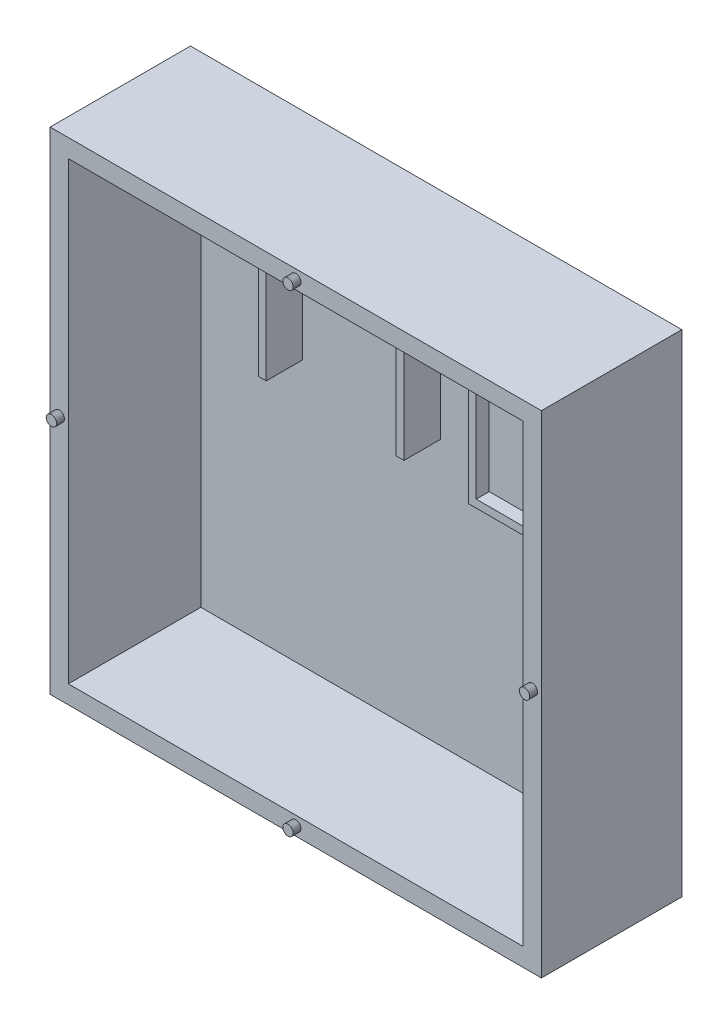
from build123d import *

# Parameters (mm, degrees)
SKETCH1_W           = 188.999995589
SKETCH1_H           = 188.999995589
BOSS_EXTRUDE1_DEPTH = 54.000001401
BOSS_EXTRUDE2_DEPTH = 2.999998629
BOSS_EXTRUDE3_DEPTH = 2.999998629
BOSS_EXTRUDE4_DEPTH = 2.999998629
BOSS_EXTRUDE5_DEPTH = 2.999998629
SKETCH6_W           = 174.999997486
SKETCH6_H           = 174.999997486
CUT_EXTRUDE1_DEPTH  = 51.000001375
BOSS_EXTRUDE6_DEPTH = 14.000000898
SKETCH8_W           = 40.000014007
SKETCH8_H           = 68.999998271
BOSS_EXTRUDE7_DEPTH = 5.000000354
SKETCH9_W           = 34.000001848
SKETCH9_H           = 63.000008464
CUT_EXTRUDE2_DEPTH  = 5.000000354


with BuildPart() as part:
    # Sketch1 → Boss-Extrude1 (new body)
    with BuildSketch(Plane(origin=(0, 0, 0), x_dir=(-1, 0, 0), z_dir=(0, 0, -1))):
        with Locations((-94.499997795, 94.499997795)):
            Rectangle(SKETCH1_W, SKETCH1_H)
    extrude(amount=-BOSS_EXTRUDE1_DEPTH)

    # Sketch2 → Boss-Extrude2 (add)
    with BuildSketch(Plane.XY.offset(54.000001401)):
        Polygon((3.152705729, 96.469610929), (3.49999941, 96.500001848), (3.847301006, 96.469610929), (4.184044898, 96.379376948), (4.500002135, 96.232049167), (4.785574973, 96.032083035), (5.032091867, 95.785565674), (5.232051015, 95.499992371), (5.379386246, 95.184035599), (5.469620228, 94.847291708), (5.500003695, 94.499990344), (5.469620228, 94.152703881), (5.379386246, 93.815952539), (5.232051015, 93.499995768), (5.032091867, 93.214422464), (4.785574973, 92.967912555), (4.500002135, 92.767946422), (4.184044898, 92.620611191), (3.847301006, 92.530377209), (3.49999941, 92.500001192), (3.152705729, 92.530377209), (2.815961838, 92.620611191), (2.500005066, 92.767946422), (2.214424312, 92.967912555), (1.967914402, 93.214422464), (1.76794827, 93.499995768), (1.620620489, 93.815952539), (1.530386391, 94.152703881), (1.500003156, 94.499990344), (1.530386391, 94.847291708), (1.620620489, 95.184035599), (1.76794827, 95.499992371), (1.967914402, 95.785565674), (2.214424312, 96.032083035), (2.500005066, 96.232049167), (2.815961838, 96.379376948), align=None)
    extrude(amount=BOSS_EXTRUDE2_DEPTH)

    # Sketch3 → Boss-Extrude3 (add)
    with BuildSketch(Plane.XY.offset(54.000001401)):
        Polygon((96.032090485, 184.214413166), (95.785573125, 183.967918158), (95.499999821, 183.767944574), (95.18404305, 183.620601892), (94.847299159, 183.530375361), (94.499997795, 183.500006795), (94.152703881, 183.530375361), (93.815967441, 183.620601892), (93.500003219, 183.767944574), (93.214422464, 183.967918158), (92.967912555, 184.214413166), (92.767953873, 184.49999392), (92.620611191, 184.815958142), (92.53038466, 185.152694583), (92.500001192, 185.499995947), (92.53038466, 185.847297311), (92.620611191, 186.184033751), (92.767953873, 186.499997973), (92.967912555, 186.785563827), (93.214422464, 187.032088637), (93.500003219, 187.232047319), (93.815967441, 187.3793751), (94.152703881, 187.469601631), (94.499997795, 187.5), (94.847299159, 187.469601631), (95.18404305, 187.3793751), (95.499999821, 187.232047319), (95.785573125, 187.032088637), (96.032090485, 186.785563827), (96.232056618, 186.499997973), (96.379384398, 186.184033751), (96.46961838, 185.847297311), (96.500001848, 185.499995947), (96.46961838, 185.152694583), (96.379384398, 184.815958142), (96.232056618, 184.49999392), align=None)
    extrude(amount=BOSS_EXTRUDE3_DEPTH)

    # Sketch4 → Boss-Extrude4 (add)
    with BuildSketch(Plane.XY.offset(54.000001401)):
        Polygon((185.847297311, 92.530377209), (185.499995947, 92.500001192), (185.152694583, 92.530377209), (184.815958142, 92.620611191), (184.49999392, 92.767946422), (184.214428067, 92.967912555), (183.967918158, 93.214422464), (183.767959476, 93.499995768), (183.620616794, 93.815952539), (183.530375361, 94.152703881), (183.500006795, 94.499990344), (183.530375361, 94.847291708), (183.620616794, 95.184035599), (183.767959476, 95.499992371), (183.967918158, 95.785565674), (184.214428067, 96.032083035), (184.49999392, 96.232049167), (184.815958142, 96.379376948), (185.152694583, 96.469610929), (185.499995947, 96.500001848), (185.847297311, 96.469610929), (186.184033751, 96.379376948), (186.499997973, 96.232049167), (186.785578728, 96.032083035), (187.032088637, 95.785565674), (187.232062221, 95.499992371), (187.379390001, 95.184035599), (187.469616532, 94.847291708), (187.5, 94.499990344), (187.469616532, 94.152703881), (187.379390001, 93.815952539), (187.232062221, 93.499995768), (187.032088637, 93.214422464), (186.785578728, 92.967912555), (186.499997973, 92.767946422), (186.184033751, 92.620611191), align=None)
    extrude(amount=BOSS_EXTRUDE4_DEPTH)

    # Sketch5 → Boss-Extrude5 (add)
    with BuildSketch(Plane.XY.offset(54.000001401)):
        Polygon((92.967912555, 2.214424312), (92.767953873, 2.499997616), (92.620611191, 2.815954387), (92.53038466, 3.152698278), (92.500001192, 3.49999941), (92.53038466, 3.847293556), (92.620611191, 4.184036981), (92.767953873, 4.499994218), (92.967912555, 4.785574973), (93.214422464, 5.032084882), (93.500003219, 5.232051015), (93.815967441, 5.379378796), (94.152703881, 5.469612777), (94.499997795, 5.499996245), (94.847299159, 5.469612777), (95.18404305, 5.379378796), (95.499999821, 5.232051015), (95.785573125, 5.032084882), (96.032090485, 4.785574973), (96.232056618, 4.499994218), (96.379384398, 4.184036981), (96.46961838, 3.847293556), (96.500001848, 3.49999941), (96.46961838, 3.152698278), (96.379384398, 2.815954387), (96.232056618, 2.499997616), (96.032090485, 2.214424312), (95.785573125, 1.967906952), (95.499999821, 1.76794827), (95.18404305, 1.620613155), (94.847299159, 1.530379057), (94.499997795, 1.499995589), (94.152703881, 1.530379057), (93.815967441, 1.620613155), (93.500003219, 1.76794827), (93.214422464, 1.967906952), align=None)
    extrude(amount=BOSS_EXTRUDE5_DEPTH)

    # Sketch6 → Cut-Extrude1 (cut)
    with BuildSketch(Plane.XY.offset(54.000001401)):
        with Locations((94.499997562, 94.499997562)):
            Rectangle(SKETCH6_W, SKETCH6_H)
    extrude(amount=-CUT_EXTRUDE1_DEPTH, mode=Mode.SUBTRACT)

    # Sketch7 → Boss-Extrude6 (add)
    with BuildSketch(Plane.XY.offset(3.000000026)):
        Polygon((96.136428416, 160.99999845), (46.136427671, 160.99999845), (46.136427671, 108.999997377), (43.136429042, 108.999997377), (43.136429042, 164.00000453), (99.136427045, 164.00000453), (99.136427045, 108.999997377), (96.136428416, 108.999997377), align=None)
    extrude(amount=BOSS_EXTRUDE6_DEPTH)

    # Sketch8 → Boss-Extrude7 (add)
    with BuildSketch(Plane.XY.offset(3.000000026)):
        with Locations((134.927961976, 132.499996573)):
            Rectangle(SKETCH8_W, SKETCH8_H)
    extrude(amount=BOSS_EXTRUDE7_DEPTH)

    # Sketch9 → Cut-Extrude2 (cut)
    with BuildSketch(Plane.XY.offset(8.00000038)):
        with Locations((134.927961975, 132.500000298)):
            Rectangle(SKETCH9_W, SKETCH9_H)
    extrude(amount=-CUT_EXTRUDE2_DEPTH, mode=Mode.SUBTRACT)


solid = part.part
